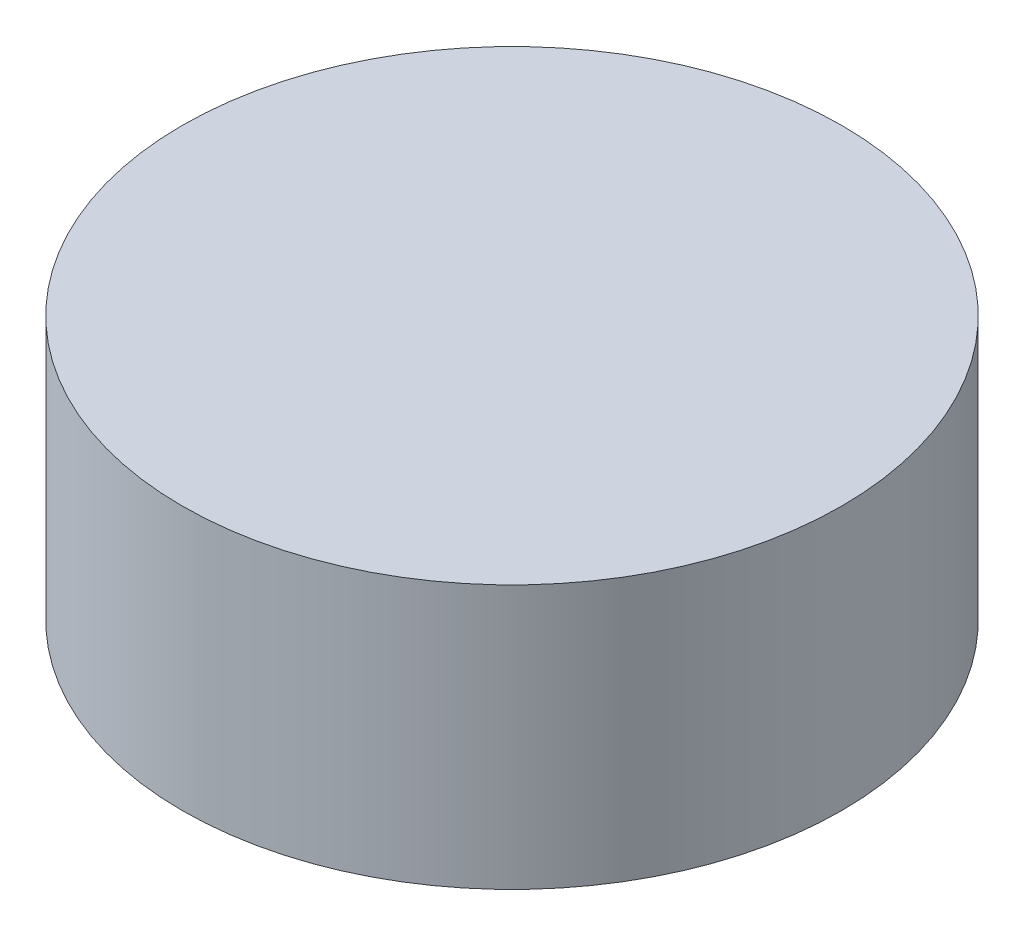
from build123d import *

# Parameters (mm, degrees)
CROQUIS1_R              = 2.5
SALIENTE_EXTRUIR1_DEPTH = 2


with BuildPart() as part:
    # Croquis1 → Saliente-Extruir1 (new body)
    with BuildSketch(Plane(origin=(0, 0, 0), x_dir=(1, 0, 0), z_dir=(0, 1, 0))):
        with Locations(Location((0, 0, 0), (0, 0, 270))):
            Circle(CROQUIS1_R)
    extrude(amount=SALIENTE_EXTRUIR1_DEPTH)


solid = part.part
